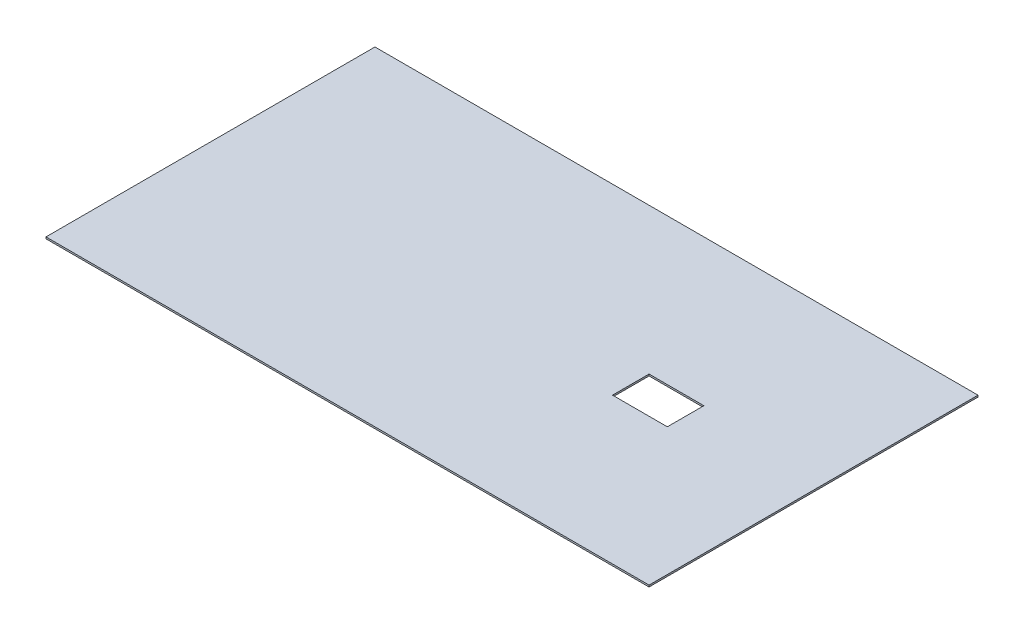
from build123d import *

# Parameters (mm, degrees)
SKETCH1_W           = 838.2
SKETCH1_H           = 457.2
BOSS_EXTRUDE1_DEPTH = 2.38125
SKETCH3_W           = 76.2
SKETCH3_H           = 50.8
CUT_EXTRUDE1_DEPTH  = 955.786232804


with BuildPart() as part:
    # Sketch1 → Boss-Extrude1 (new body)
    with BuildSketch(Plane(origin=(0, 0, 0), x_dir=(1, 0, 0), z_dir=(0, 1, 0))):
        with Locations((419.1, 228.6)):
            Rectangle(SKETCH1_W, SKETCH1_H)
    extrude(amount=BOSS_EXTRUDE1_DEPTH)

    # Sketch3 → Cut-Extrude1 (cut, through all)
    with BuildSketch(Plane(origin=(0, 2.38125, 0), x_dir=(1, 0, 0), z_dir=(0, 1, 0))):
        with Locations((622.3, 228.6)):
            Rectangle(SKETCH3_W, SKETCH3_H)
    extrude(amount=-CUT_EXTRUDE1_DEPTH, mode=Mode.SUBTRACT)


solid = part.part
